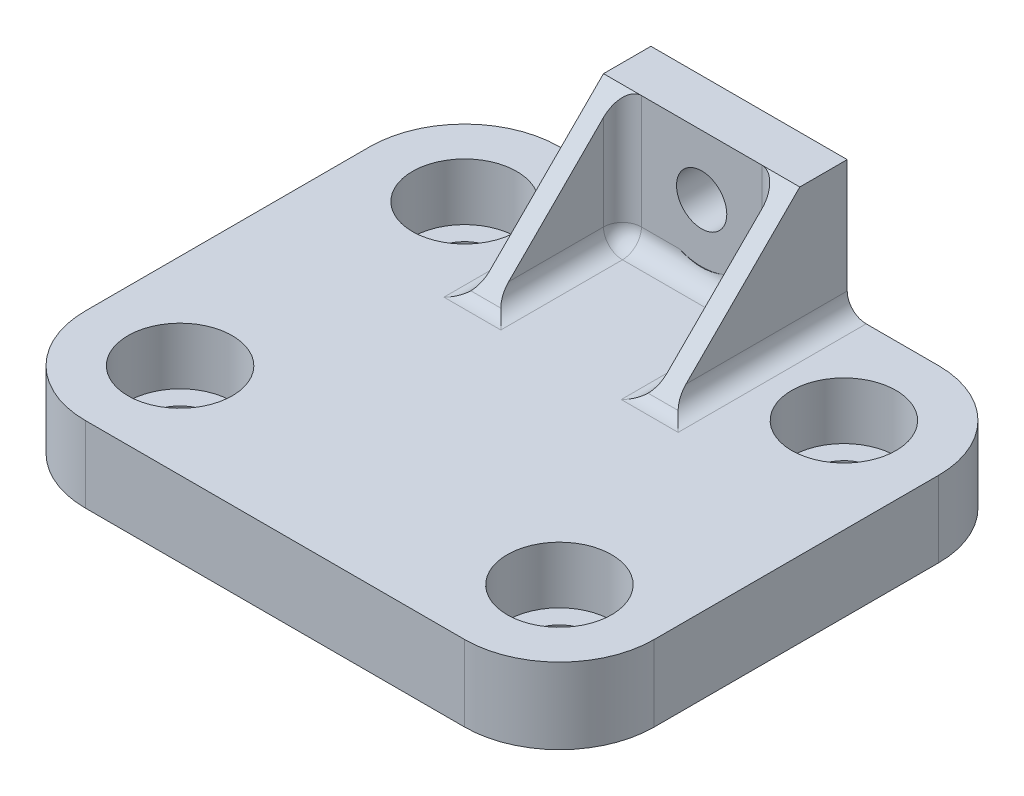
from build123d import *

# Parameters (mm, degrees)
SKETCH1_W                      = 60
SKETCH1_H                      = 50
BOSS_EXTRUDE1_DEPTH            = 8
FILLET1_R                      = 10
CBORE_FOR_M6_SHCS1_D           = 6.6
CBORE_FOR_M6_SHCS1_DEPTH       = 10.1
CBORE_FOR_M6_SHCS1_CBORE_D     = 11
CBORE_FOR_M6_SHCS1_CBORE_DEPTH = 6
CBORE_FOR_M6_SHCS1_TIP         = 1.982840043
SKETCH4_W                      = 16.7
SKETCH4_H                      = 14
BOSS_EXTRUDE2_DEPTH            = 5
M5_CLEARANCE_HOLE1_D           = 5.3
M5_CLEARANCE_HOLE1_DEPTH       = 10
M5_CLEARANCE_HOLE1_TIP         = 1.59228064
BOSS_EXTRUDE3_DEPTH            = 2
FILLET2_R                      = 2
SKETCH8_R                      = 6.12
CUT_EXTRUDE1_DEPTH             = 59.386642308


with BuildPart() as part:
    # Sketch1 → Boss-Extrude1 (new body)
    with BuildSketch(Plane(origin=(0, 0, 0), x_dir=(1, 0, 0), z_dir=(0, 1, 0))):
        Rectangle(SKETCH1_W, SKETCH1_H)
    extrude(amount=BOSS_EXTRUDE1_DEPTH)

    # Fillet1
    fillet1_edges = [part.edges().sort_by_distance(p)[0] for p in [
        (30, 4, 25),
        (-30, 4, 25),
        (-30, 4, -25),
        (30, 4, -25),
    ]]
    fillet(fillet1_edges, radius=FILLET1_R)

    # CBORE for M6 SHCS1
    with Locations(Plane(origin=(0, 8, 0), x_dir=(1, 0, 0), z_dir=(0, 1, 0))):
        with Locations((-20, 15), (-20, -15), (20, -15), (20, 15)):
            CounterBoreHole(CBORE_FOR_M6_SHCS1_D / 2, CBORE_FOR_M6_SHCS1_CBORE_D / 2, CBORE_FOR_M6_SHCS1_CBORE_DEPTH, depth=CBORE_FOR_M6_SHCS1_DEPTH)
            with Locations((0, 0, -(CBORE_FOR_M6_SHCS1_DEPTH + CBORE_FOR_M6_SHCS1_TIP / 2))):  # 118° drill point
                Cone(0, CBORE_FOR_M6_SHCS1_D / 2, CBORE_FOR_M6_SHCS1_TIP, mode=Mode.SUBTRACT)

    # Sketch4 → Boss-Extrude2 (add)
    with BuildSketch(Plane(origin=(0, 0, -25), x_dir=(-1, 0, 0), z_dir=(0, 0, -1))):
        with Locations((0, 15)):
            Rectangle(SKETCH4_W, SKETCH4_H)
    extrude(amount=-BOSS_EXTRUDE2_DEPTH)

    # M5 Clearance Hole1
    with Locations(Plane.XY.offset(-20)):
        with Locations((0, 15.65)):
            Hole(M5_CLEARANCE_HOLE1_D / 2, depth=M5_CLEARANCE_HOLE1_DEPTH)
            with Locations((0, 0, -(M5_CLEARANCE_HOLE1_DEPTH + M5_CLEARANCE_HOLE1_TIP / 2))):  # 118° drill point
                Cone(0, M5_CLEARANCE_HOLE1_D / 2, M5_CLEARANCE_HOLE1_TIP, mode=Mode.SUBTRACT)

    # Sketch7 → Boss-Extrude3 (add)
    with BuildSketch(Plane(origin=(8.35, 0, 0), x_dir=(0, 0, -1), z_dir=(1, 0, 0))):
        Polygon((20, 22), (6, 8), (25, 8), (25, 22), align=None)
    boss_extrude3 = extrude(amount=BOSS_EXTRUDE3_DEPTH)

    # Mirror1: Boss-Extrude3 across plane
    add(boss_extrude3.mirror(Plane(origin=(0, 0, 0), x_dir=(0, 0, 1), z_dir=(1, 0, 0))))

    # Fillet2
    fillet2_edges = [part.edges().sort_by_distance(p)[0] for p in [
        (-10.35, 8, -15.5),
        (-9.35, 8, -6),
        (-8.35, 8, -13),
        (0, 8, -20),
        (8.35, 15, -20),
        (-8.35, 15, -20),
        (8.35, 8, -13),
        (9.35, 8, -6),
        (10.35, 8, -15.5),
    ]]
    fillet(fillet2_edges, radius=FILLET2_R)

    # Sketch8 → Cut-Extrude1 (cut, through all)
    with BuildSketch(Plane.XY.offset(-20)):
        with Locations((0, 15.65)):
            Circle(SKETCH8_R)
    extrude(amount=CUT_EXTRUDE1_DEPTH, mode=Mode.SUBTRACT)


solid = part.part
